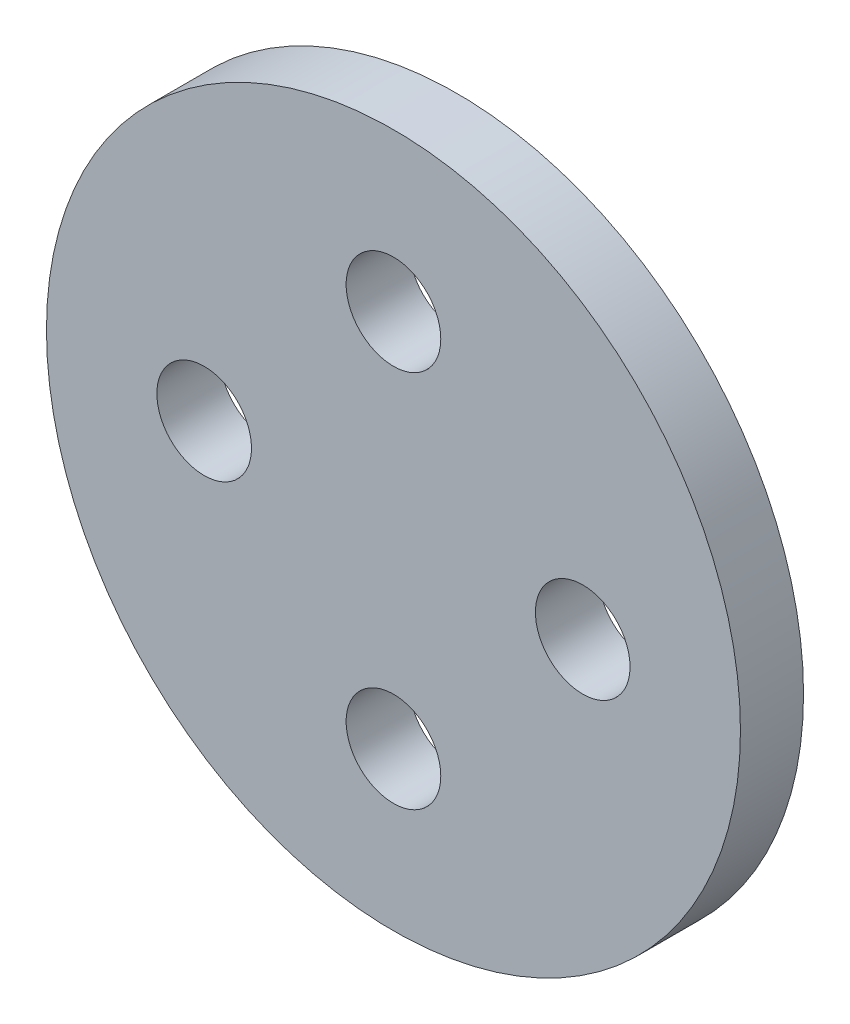
from build123d import *

# Parameters (mm, degrees)
SKETCH1_R           = 17.4625
SKETCH1_R_2         = 2.38125
BOSS_EXTRUDE1_DEPTH = 3.175


with BuildPart() as part:
    # Sketch1 → Boss-Extrude1 (new body)
    with BuildSketch(Plane.XY):
        Circle(SKETCH1_R)
        with Locations((0, 9.525)):
            Circle(SKETCH1_R_2, mode=Mode.SUBTRACT)
        with Locations((9.525, 0)):
            Circle(SKETCH1_R_2, mode=Mode.SUBTRACT)
        with Locations((0, -9.525)):
            Circle(SKETCH1_R_2, mode=Mode.SUBTRACT)
        with Locations((-9.525, 0)):
            Circle(SKETCH1_R_2, mode=Mode.SUBTRACT)
    extrude(amount=BOSS_EXTRUDE1_DEPTH)


solid = part.part
